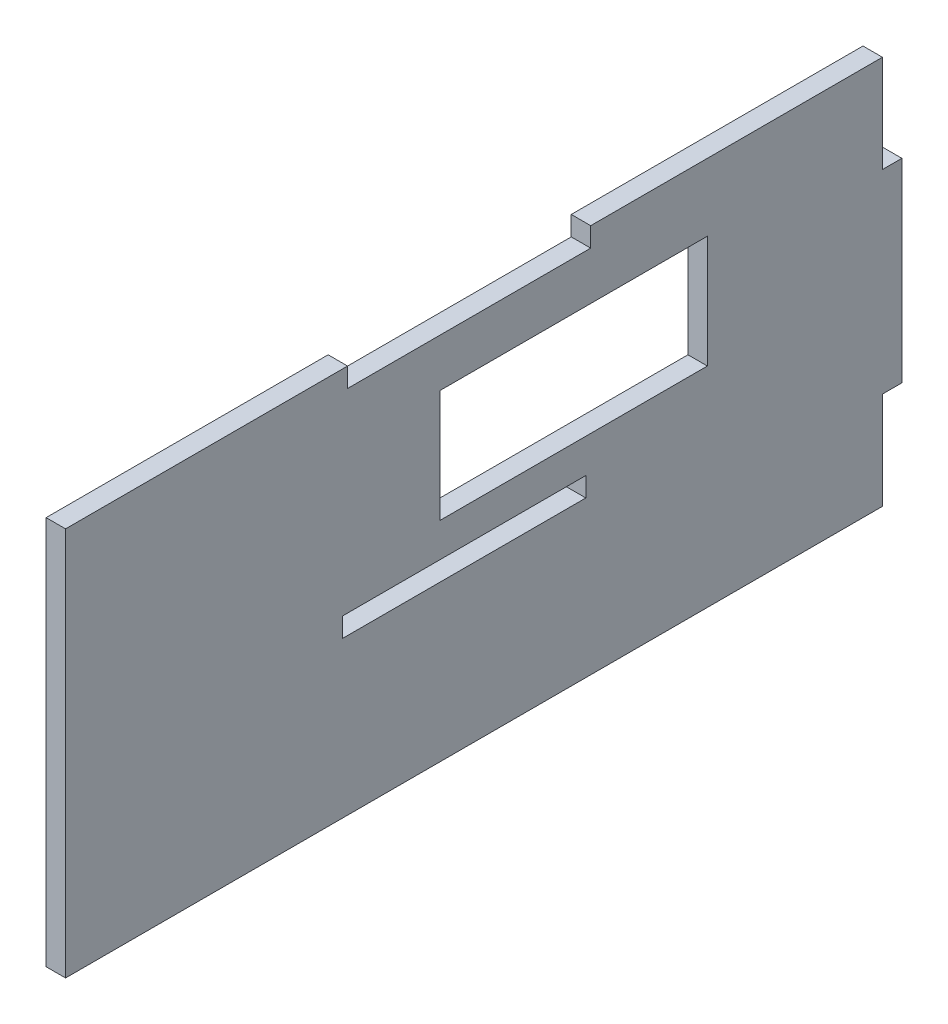
from build123d import *

# Parameters (mm, degrees)
SKETCH_1_W          = 174
SKETCH_1_H          = 80
EXTRUDE_1_DEPTH     = 4
SKETCH_3_W          = 4
SKETCH_3_H          = 20
CUT_EXTRUDE_1_DEPTH = 4
SKETCH_4_W          = 50
SKETCH_4_H          = 4
CUT_EXTRUDE_2_DEPTH = 4
SKETCH_5_W          = 2
SKETCH_5_H          = 80
CUT_EXTRUDE_3_DEPTH = 10
SKETCH_8_W          = 50
SKETCH_8_H          = 4
CUT_EXTRUDE_4_DEPTH = 4
SKETCH_9_W          = 55
SKETCH_9_H          = 23.130254534
CUT_EXTRUDE_5_DEPTH = 4


with BuildPart() as part:
    # 스케치1 → 보스-돌출1 (new body)
    with BuildSketch(Plane(origin=(0, 0, 0), x_dir=(0, 0, -1), z_dir=(1, 0, 0))):
        Rectangle(SKETCH_1_W, SKETCH_1_H)
    extrude(amount=EXTRUDE_1_DEPTH)

    # 스케치3 → 컷-돌출1 (cut)
    with BuildSketch(Plane(origin=(4, 0, 0), x_dir=(0, 0, -1), z_dir=(1, 0, 0))):
        with Locations((85, 30)):
            Rectangle(SKETCH_3_W, SKETCH_3_H)
        with Locations((85, -30)):
            Rectangle(SKETCH_3_W, SKETCH_3_H)
    extrude(amount=-CUT_EXTRUDE_1_DEPTH, mode=Mode.SUBTRACT)

    # 스케치4 → 컷-돌출2 (cut)
    with BuildSketch(Plane(origin=(4, 0, 0), x_dir=(0, 0, -1), z_dir=(1, 0, 0))):
        with Locations((-2, 38)):
            Rectangle(SKETCH_4_W, SKETCH_4_H)
    extrude(amount=-CUT_EXTRUDE_2_DEPTH, mode=Mode.SUBTRACT)

    # 스케치5 → 컷-돌출3 (cut)
    with BuildSketch(Plane.ZY):
        with Locations((86, 0)):
            Rectangle(SKETCH_5_W, SKETCH_5_H)
    extrude(amount=-CUT_EXTRUDE_3_DEPTH, mode=Mode.SUBTRACT)

    # 스케치8 → 컷-돌출4 (cut)
    with BuildSketch(Plane.ZY):
        with Locations((3, -6)):
            Rectangle(SKETCH_8_W, SKETCH_8_H)
    extrude(amount=-CUT_EXTRUDE_4_DEPTH, mode=Mode.SUBTRACT)

    # 스케치9 → 컷-돌출5 (cut)
    with BuildSketch(Plane.ZY):
        with Locations((-19.5, 14.565127267)):
            Rectangle(SKETCH_9_W, SKETCH_9_H)
    extrude(amount=-CUT_EXTRUDE_5_DEPTH, mode=Mode.SUBTRACT)


solid = part.part
